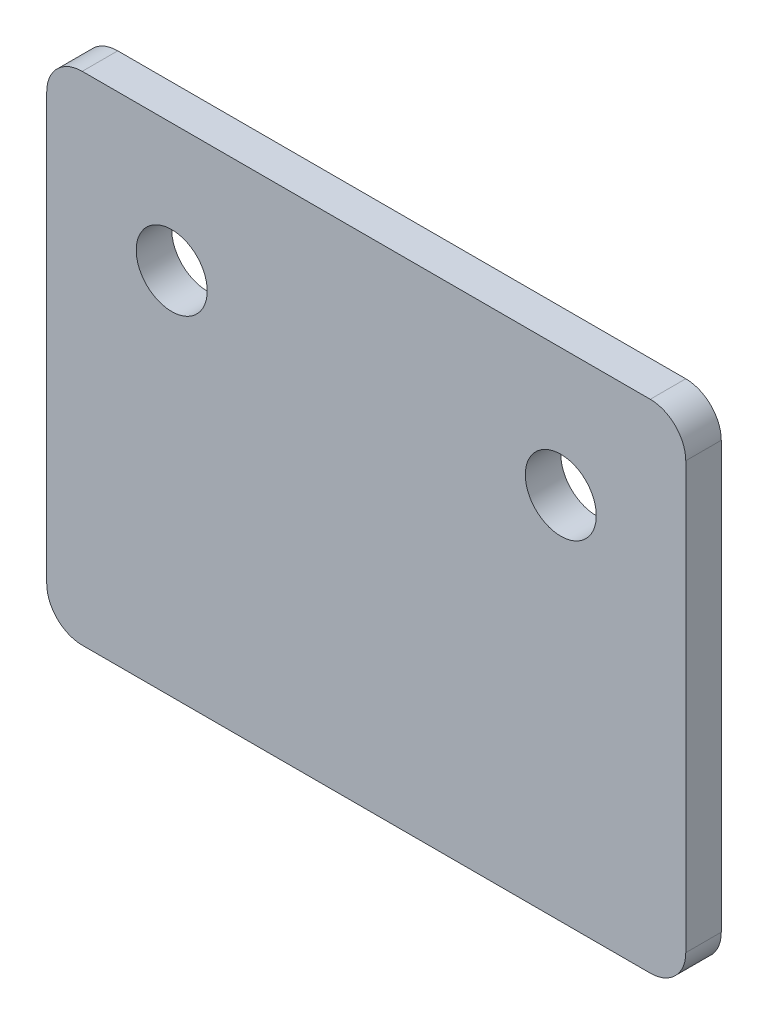
from build123d import *

# Parameters (mm, degrees)
BOSS_EXTRUDE1_DEPTH = 3.175
SKETCH2_R           = 3.175
CUT_EXTRUDE1_DEPTH  = 48.961405128


with BuildPart() as part:
    # Sketch1 → Boss-Extrude1 (new body)
    with BuildSketch(Plane.XY):
        with BuildLine():
            Line((-28.328951223, 3.070773738), (-28.328951223, -35.029226262))
            ThreePointArc((-28.328951223, -35.029226262), (-27.399015253, -37.274290292), (-25.153951223, -38.204226262))
            Line((-25.153951223, -38.204226262), (25.646048777, -38.204226262))
            ThreePointArc((25.646048777, -38.204226262), (27.891112807, -37.274290292), (28.821048777, -35.029226262))
            Line((28.821048777, -35.029226262), (28.821048777, 3.070773738))
            ThreePointArc((28.821048777, 3.070773738), (27.891112807, 5.315837768), (25.646048777, 6.245773738))
            Line((25.646048777, 6.245773738), (-25.153951223, 6.245773738))
            ThreePointArc((-25.153951223, 6.245773738), (-27.399015253, 5.315837768), (-28.328951223, 3.070773738))
        make_face()
    extrude(amount=-BOSS_EXTRUDE1_DEPTH)

    # Sketch2 → Cut-Extrude1 (cut, through all)
    with BuildSketch(Plane.XY):
        with Locations((-17.152951223, -5.184226262)):
            Circle(SKETCH2_R)
        with Locations(Location((17.645048777, -5.184226262, 0), (0, 0, 180))):
            Circle(SKETCH2_R)
    extrude(amount=-CUT_EXTRUDE1_DEPTH, mode=Mode.SUBTRACT)


solid = part.part
